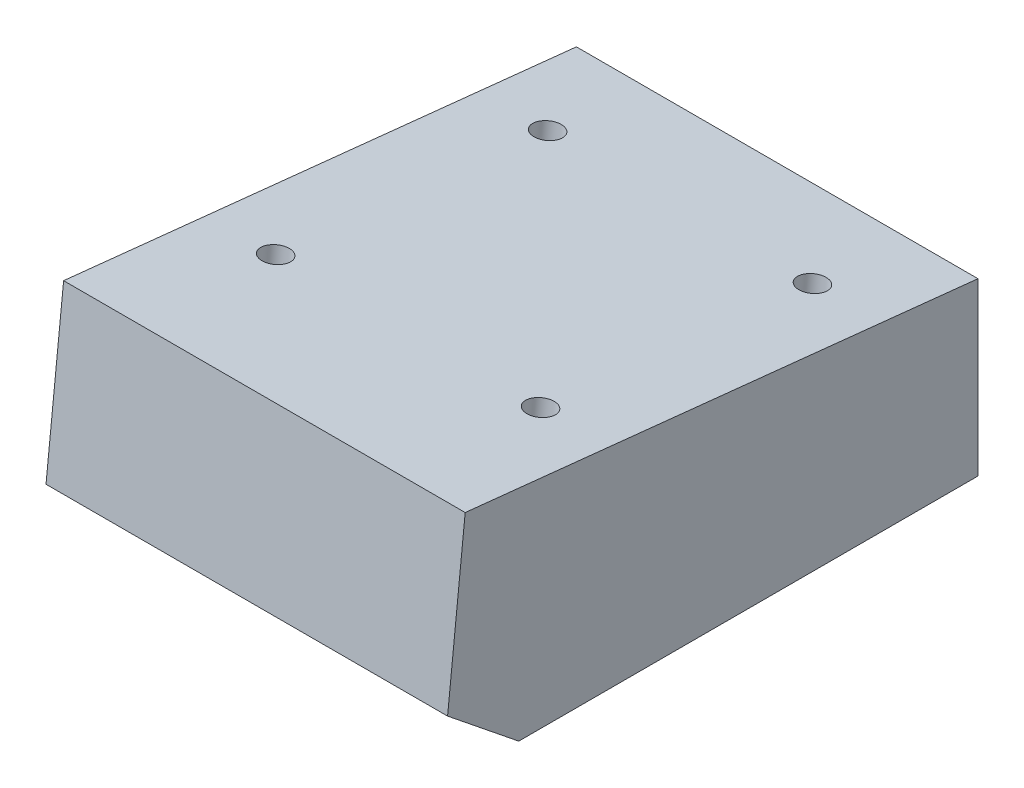
from build123d import *

# Parameters (mm, degrees)
BOSS_EXTRU_1_DEPTH                            = 23.5
BOSS_EXTRU_1_DEPTH_BACK                       = 23.5
ESQUISSE2_W                                   = 45.2
ESQUISSE2_H                                   = 53.75
ENL_V_MAT_EXTRU_1_DEPTH                       = 4.05
ENL_V_MAT_EXTRU_2_REACH                       = 63.688
ESQUISSE3_R                                   = 1.6
TROU_POUR_TARAUDAGE_POUR_TROU_TARAUD_M3_D     = 2.5
TROU_POUR_TARAUDAGE_POUR_TROU_TARAUD_M3_DEPTH = 5
TROU_POUR_TARAUDAGE_POUR_TROU_TARAUD_M3_TIP   = 0.751075774


with BuildPart() as part:
    # Esquisse1 → Boss.-Extru.1 (new, two sides: drawn at the far end of the back side and taken through both)
    with BuildSketch(Plane(origin=(0, 0, 0), x_dir=(0, 0, -1), z_dir=(1, 0, 0)).offset(-BOSS_EXTRU_1_DEPTH_BACK)):
        Polygon((53.75, 20), (-6.267855155, 26.308130768), (-8.328471366, 6.702677141), (0, 0), (53.75, 0), align=None)
    extrude(amount=BOSS_EXTRU_1_DEPTH + BOSS_EXTRU_1_DEPTH_BACK)

    # Esquisse2 → Enlèv. mat.-Extru.1 (cut)
    with BuildSketch(Plane.XZ):
        with Locations((0, -26.875)):
            Rectangle(ESQUISSE2_W, ESQUISSE2_H)
    extrude(amount=-ENL_V_MAT_EXTRU_1_DEPTH, mode=Mode.SUBTRACT)

    # Enlèv. mat.-Extru.2: up to this plane
    enl_v_mat_extru_2_end = Plane(origin=(0, 4.05, 0), z_dir=(0, -1, 0))
    # Esquisse3 → Enlèv. mat.-Extru.2 (cut, up to the surface)
    with BuildSketch(Plane(origin=(0, 25.369102698, -2.666400138), x_dir=(1, 0, 0), z_dir=(0, 0.9945218953682741, -0.10452846326764641)), mode=Mode.PRIVATE) as enl_v_mat_extru_2_sk1:
        with Locations(Location((-15.5, 39.929033745, 0), (0, 0, 270))):
            Circle(ESQUISSE3_R)
    enl_v_mat_extru_2_tool1 = split(extrude(enl_v_mat_extru_2_sk1.sketch, amount=-ENL_V_MAT_EXTRU_2_REACH, mode=Mode.PRIVATE), bisect_by=enl_v_mat_extru_2_end, keep=Keep.BOTH, mode=Mode.PRIVATE)
    add(enl_v_mat_extru_2_tool1.solids().sort_by_distance((-15.5, 21.195382, -42.376698))[0], mode=Mode.SUBTRACT)
    # Esquisse3 → Enlèv. mat.-Extru.2 (cut, up to the surface)
    with BuildSketch(Plane(origin=(0, 25.369102698, -2.666400138), x_dir=(1, 0, 0), z_dir=(0, 0.9945218953682741, -0.10452846326764641)), mode=Mode.PRIVATE) as enl_v_mat_extru_2_sk2:
        with Locations(Location((15.5, 39.929033745, 0), (0, 0, 270))):
            Circle(ESQUISSE3_R)
    enl_v_mat_extru_2_tool2 = split(extrude(enl_v_mat_extru_2_sk2.sketch, amount=-ENL_V_MAT_EXTRU_2_REACH, mode=Mode.PRIVATE), bisect_by=enl_v_mat_extru_2_end, keep=Keep.BOTH, mode=Mode.PRIVATE)
    add(enl_v_mat_extru_2_tool2.solids().sort_by_distance((15.5, 21.195382, -42.376698))[0], mode=Mode.SUBTRACT)
    # Esquisse3 → Enlèv. mat.-Extru.2 (cut, up to the surface)
    with BuildSketch(Plane(origin=(0, 25.369102698, -2.666400138), x_dir=(1, 0, 0), z_dir=(0, 0.9945218953682741, -0.10452846326764641)), mode=Mode.PRIVATE) as enl_v_mat_extru_2_sk3:
        with Locations(Location((15.5, 7.929033745, 0), (0, 0, 270))):
            Circle(ESQUISSE3_R)
    enl_v_mat_extru_2_tool3 = split(extrude(enl_v_mat_extru_2_sk3.sketch, amount=-ENL_V_MAT_EXTRU_2_REACH, mode=Mode.PRIVATE), bisect_by=enl_v_mat_extru_2_end, keep=Keep.BOTH, mode=Mode.PRIVATE)
    add(enl_v_mat_extru_2_tool3.solids().sort_by_distance((15.5, 24.540293, -10.551998))[0], mode=Mode.SUBTRACT)
    # Esquisse3 → Enlèv. mat.-Extru.2 (cut, up to the surface)
    with BuildSketch(Plane(origin=(0, 25.369102698, -2.666400138), x_dir=(1, 0, 0), z_dir=(0, 0.9945218953682741, -0.10452846326764641)), mode=Mode.PRIVATE) as enl_v_mat_extru_2_sk4:
        with Locations(Location((-15.5, 7.929033745, 0), (0, 0, 270))):
            Circle(ESQUISSE3_R)
    enl_v_mat_extru_2_tool4 = split(extrude(enl_v_mat_extru_2_sk4.sketch, amount=-ENL_V_MAT_EXTRU_2_REACH, mode=Mode.PRIVATE), bisect_by=enl_v_mat_extru_2_end, keep=Keep.BOTH, mode=Mode.PRIVATE)
    add(enl_v_mat_extru_2_tool4.solids().sort_by_distance((-15.5, 24.540293, -10.551998))[0], mode=Mode.SUBTRACT)

    # Trou pour taraudage pour trou taraudé M31
    with Locations(Plane(origin=(0, 0, 0), x_dir=(-1, 0, 0), z_dir=(0, -0.779044883952261, 0.6269681561194383))):
        with Locations((13.5, -5.548250916), (-13.5, -5.548250916)):
            Hole(TROU_POUR_TARAUDAGE_POUR_TROU_TARAUD_M3_D / 2, depth=TROU_POUR_TARAUDAGE_POUR_TROU_TARAUD_M3_DEPTH)
            with Locations((0, 0, -(TROU_POUR_TARAUDAGE_POUR_TROU_TARAUD_M3_DEPTH + TROU_POUR_TARAUDAGE_POUR_TROU_TARAUD_M3_TIP / 2))):  # 118° drill point
                Cone(0, TROU_POUR_TARAUDAGE_POUR_TROU_TARAUD_M3_D / 2, TROU_POUR_TARAUDAGE_POUR_TROU_TARAUD_M3_TIP, mode=Mode.SUBTRACT)


solid = part.part
